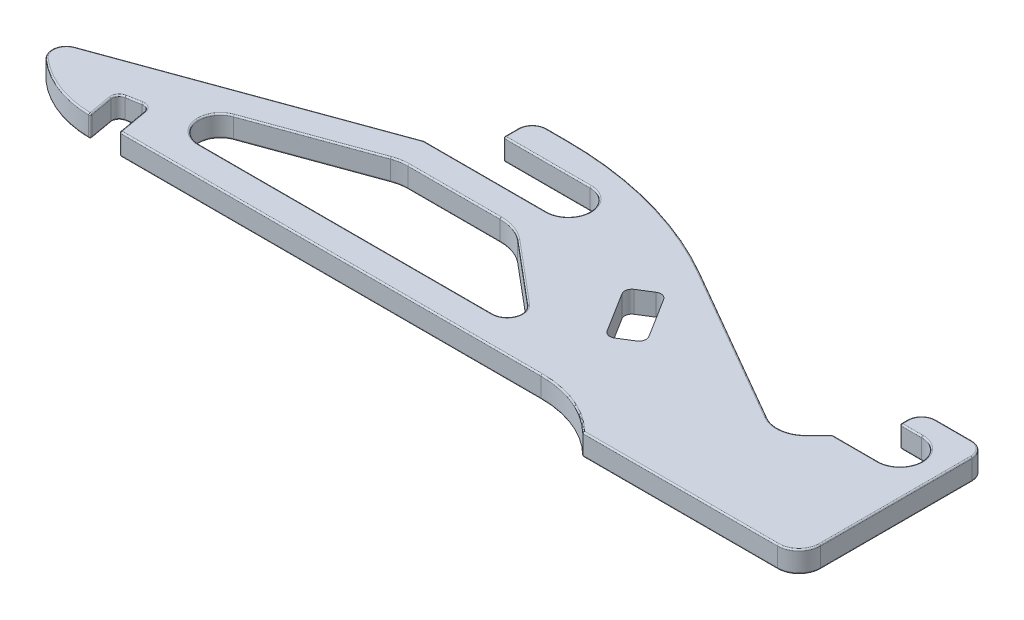
from build123d import *

# Parameters (mm, degrees)
BOSS_EXTRUDE1_DEPTH = 3
FILLET1_R           = 0.2


with BuildPart() as part:
    # Sketch1 → Boss-Extrude1 (new body)
    with BuildSketch(Plane(origin=(0, 0, 0), x_dir=(1, 0, 0), z_dir=(0, 1, 0))):
        with BuildLine():
            Line((0, -3), (-17, -3))
            Line((-17, -3), (-52.517861023, -15.927444197))
            ThreePointArc((-52.517861023, -15.927444197), (-53.800236603, -17.441851852), (-53.146716234, -19.315572429))
            ThreePointArc((-53.146716234, -19.315572429), (-48.556729666, -22.048729239), (-43.3, -23))
            Line((-43.3, -23), (-43.907768622, -19.553172864))
            ThreePointArc((-43.907768622, -19.553172864), (-43.742112913, -18.80594825), (-43.096609046, -18.394716934))
            Line((-43.096609046, -18.394716934), (-41.12699354, -18.047420578))
            ThreePointArc((-41.12699354, -18.047420578), (-40.379768926, -18.213076287), (-39.96853761, -18.858580154))
            Line((-39.96853761, -18.858580154), (-39.238293552, -23))
            Line((-39.238293552, -23), (19.202041029, -23))
            ThreePointArc((19.202041029, -23), (24.493543651, -24.038518603), (29, -27))
            Line((29, -27), (56, -27))
            ThreePointArc((56, -27), (58.121320344, -26.121320344), (59, -24))
            Line((59, -24), (59, -3))
            ThreePointArc((59, -3), (58.414213562, -1.585786438), (57, -1))
            Line((57, -1), (52, -1))
            ThreePointArc((52, -1), (50.585786438, -1.585786438), (50, -3))
            Line((50, -3), (50, -4))
            Line((50, -4), (53, -4))
            ThreePointArc((53, -4), (56, -7), (53, -10))
            Line((53, -10), (46.656854249, -10))
            Line((46.656854249, -10), (44.828427125, -11.828427125))
            ThreePointArc((44.828427125, -11.828427125), (42.522104769, -12.965779445), (40, -12.464101615))
            Line((40, -12.464101615), (17.889727457, 0.301270189))
            ThreePointArc((17.889727457, 0.301270189), (5.830679712, 5.296291314), (-7.110272543, 7))
            Line((-7.110272543, 7), (-10, 7))
            ThreePointArc((-10, 7), (-11.414213562, 6.414213562), (-12, 5))
            Line((-12, 5), (-12, 3))
            Line((-12, 3), (0, 3))
            ThreePointArc((0, 3), (3, 0), (0, -3))
        make_face()
        with BuildLine():
            Line((-2.478513483, -7), (-15.236730193, -7))
            ThreePointArc((-15.236730193, -7), (-16.278619259, -7.091153482), (-17.288851053, -7.361844275))
            Line((-17.288851053, -7.361844275), (-33.276636082, -13.180922138))
            ThreePointArc((-33.276636082, -13.180922138), (-35.204998911, -16.520944533), (-32.250575652, -19))
            Line((-32.250575652, -19), (8.511396195, -19))
            ThreePointArc((8.511396195, -19), (10.390781437, -17.684040287), (9.796971414, -15.467911114))
            Line((9.796971414, -15.467911114), (1.378212175, -8.403733341))
            ThreePointArc((1.378212175, -8.403733341), (-0.426392623, -7.361844275), (-2.478513483, -7))
        make_face(mode=Mode.SUBTRACT)
        with BuildLine():
            Line((15.112176312, -7.672588307), (18.55665153, -13.184900932))
            ThreePointArc((18.55665153, -13.184900932), (19.179748572, -13.629351733), (19.93461889, -13.503029764))
            Line((19.93461889, -13.503029764), (21.800324702, -12.337207383))
            ThreePointArc((21.800324702, -12.337207383), (22.244775502, -11.714110341), (22.118453534, -10.959240022))
            Line((22.118453534, -10.959240022), (18.673978316, -5.446927397))
            ThreePointArc((18.673978316, -5.446927397), (18.050881274, -5.002476597), (17.296010956, -5.128798566))
            Line((17.296010956, -5.128798566), (15.430305144, -6.294620947))
            ThreePointArc((15.430305144, -6.294620947), (14.985854344, -6.917717989), (15.112176312, -7.672588307))
        make_face(mode=Mode.SUBTRACT)
    extrude(amount=BOSS_EXTRUDE1_DEPTH)

    # Fillet1
    fillet1_edges = [part.edges().sort_by_distance(p)[0] for p in [
        (58.121320344, 3, 26.121320344),
        (59, 3, 13.5),
        (58.414213562, 3, 1.585786438),
        (54.5, 3, 1),
        (50.585786438, 3, 1.585786438),
        (50, 3, 3.5),
        (51.5, 3, 4),
        (56, 3, 7),
        (49.828427125, 3, 10),
        (45.742640687, 3, 10.914213562),
        (42.522104769, 3, 12.965779445),
        (28.944863729, 3, 6.081415713),
        (5.830679712, 3, -5.296291314),
        (-8.555136271, 3, -7),
        (-11.414213562, 3, -6.414213562),
        (-12, 3, -4),
        (-6, 3, -3),
        (3, 3, 0),
        (-8.5, 3, 3),
        (-34.758930511, 3, 9.463722099),
        (-53.800236603, 3, 17.441851852),
        (-48.556729666, 3, 22.048729239),
        (-16.278619259, 3, 7.091153482),
        (-8.857621838, 3, 7),
        (-48.556729666, 0, 22.048729239),
        (-53.800236603, 0, 17.441851852),
        (-34.758930511, 0, 9.463722099),
        (-8.5, 0, 3),
        (3, 0, 0),
        (-6, 0, -3),
        (-0.426392623, 3, 7.361844275),
        (-12, 0, -4),
        (-11.414213562, 0, -6.414213562),
        (-8.555136271, 0, -7),
        (5.830679712, 0, -5.296291314),
        (28.944863729, 0, 6.081415713),
        (42.522104769, 0, 12.965779445),
        (45.742640687, 0, 10.914213562),
        (49.828427125, 0, 10),
        (5.587591795, 3, 11.935822228),
        (56, 0, 7),
        (51.5, 0, 4),
        (50, 0, 3.5),
        (50.585786438, 0, 1.585786438),
        (54.5, 0, 1),
        (58.414213562, 0, 1.585786438),
        (59, 0, 13.5),
        (58.121320344, 0, 26.121320344),
        (10.390781437, 3, 17.684040287),
        (42.5, 0, 27),
        (24.493543651, 0, 24.038518603),
        (-10.018126262, 0, 23),
        (-39.603415581, 0, 20.929290077),
        (-40.379768926, 0, 18.213076287),
        (-42.111801293, 0, 18.221068756),
        (-43.742112913, 0, 18.80594825),
        (-43.603884311, 0, 21.276586432),
        (-11.869589728, 3, 19),
        (-25.282743567, 0, 10.271383206),
        (-35.204998911, 0, 16.520944533),
        (-11.869589728, 0, 19),
        (10.390781437, 0, 17.684040287),
        (5.587591795, 0, 11.935822228),
        (-0.426392623, 0, 7.361844275),
        (-8.857621838, 0, 7),
        (-16.278619259, 0, 7.091153482),
        (-35.204998911, 3, 16.520944533),
        (-25.282743567, 3, 10.271383206),
        (-43.603884311, 3, 21.276586432),
        (-43.742112913, 3, 18.80594825),
        (-42.111801293, 3, 18.221068756),
        (-43.3, 1.5, 23),
        (-12, 1.5, -3),
        (50, 1.5, 4),
        (-40.379768926, 3, 18.213076287),
        (-39.238293552, 1.5, 23),
        (-39.603415581, 3, 20.929290077),
        (-10.018126262, 3, 23),
        (24.493543651, 3, 24.038518603),
        (42.5, 3, 27),
    ]]
    fillet(fillet1_edges, radius=FILLET1_R)


solid = part.part
